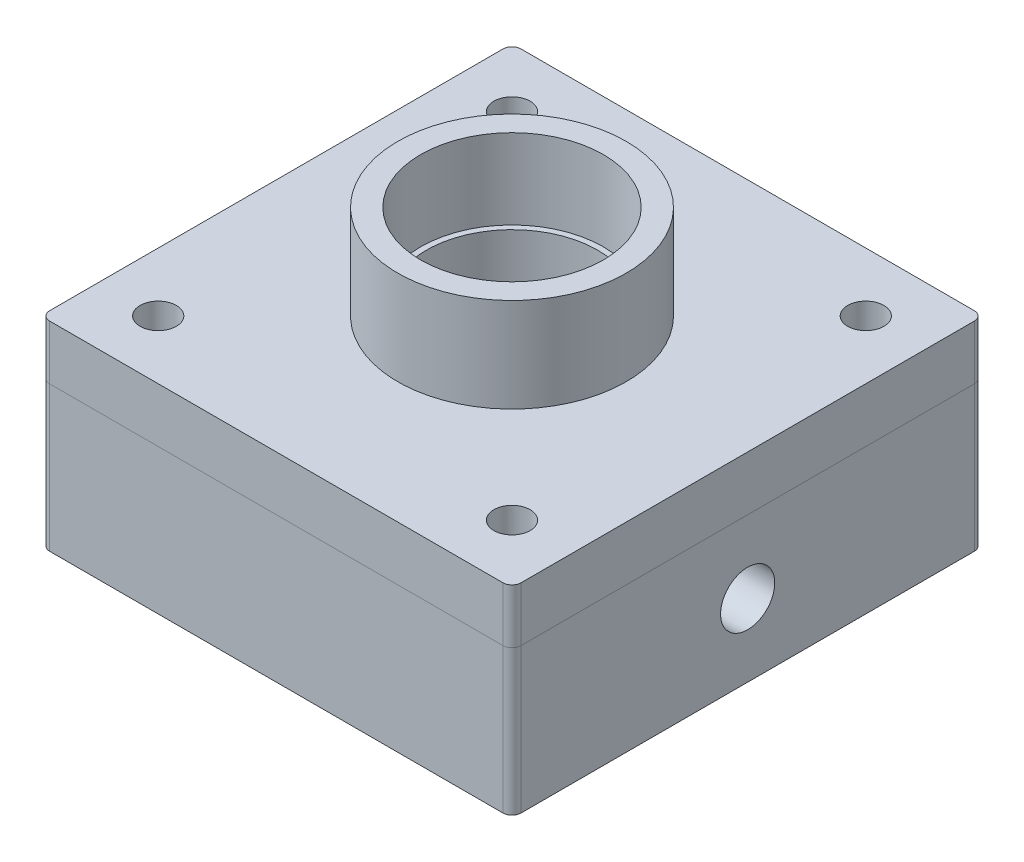
from build123d import *

# Parameters (mm, degrees)
SKETCH1_R                  = 40
SKETCH1_R_2                = 32
BOSS_EXTRUDE1_DEPTH        = 102.8
SKETCH1_3_R                = 32
SKETCH1_3_R_2              = 30
BOSS_EXTRUDE2_DEPTH        = 74.8
SKETCH1_4_R                = 30
SKETCH1_4_R_2              = 20
BOSS_EXTRUDE3_DEPTH        = 52.8
SKETCH1_5_W                = 165.1
SKETCH1_5_H                = 165.1
SKETCH1_5_R                = 6.35
SKETCH1_5_R_2              = 40
BOSS_EXTRUDE4_DEPTH        = 50.8
SKETCH2_R                  = 76.2
SKETCH2_R_2                = 69.85
CUT_EXTRUDE1_DEPTH         = 8
F_1_0MM_DOWEL_HOLE1_D      = 18.97
F_1_0MM_DOWEL_HOLE1_DEPTH  = 47.24
F_1_0MM_DOWEL_HOLE1_TIP    = 5.476167303
F_1_0MM_DOWEL_HOLE3_REACH  = 157.553
F_1_0MM_DOWEL_HOLE3_BORE_R = 6.35
SKETCH12_W                 = 165.1
SKETCH12_H                 = 165.1
SKETCH12_R                 = 40
SKETCH12_R_2               = 6.35
BOSS_EXTRUDE5_DEPTH        = 19.05
FILLET3_R                  = 3.175
FILLET4_R                  = 3.175


with BuildPart() as part:
    # Sketch1 → Boss-Extrude1 (new body)
    with BuildSketch(Plane(origin=(0, 0, 0), x_dir=(1, 0, 0), z_dir=(0, 1, 0))):
        with Locations(Location((0, 0, 0), (0, 0, 90))):
            Circle(SKETCH1_R)
        with Locations(Location((0, 0, 0), (0, 0, 90))):
            Circle(SKETCH1_R_2, mode=Mode.SUBTRACT)
    extrude(amount=BOSS_EXTRUDE1_DEPTH)

    # Sketch1<3> → Boss-Extrude2 (add)
    with BuildSketch(Plane(origin=(0, 0, 0), x_dir=(1, 0, 0), z_dir=(0, 1, 0))):
        with Locations(Location((0, 0, 0), (0, 0, 90))):
            Circle(SKETCH1_3_R)
        with Locations(Location((0, 0, 0), (0, 0, 270))):
            Circle(SKETCH1_3_R_2, mode=Mode.SUBTRACT)
    extrude(amount=BOSS_EXTRUDE2_DEPTH)

    # Sketch1<4> → Boss-Extrude3 (add)
    with BuildSketch(Plane(origin=(0, 0, 0), x_dir=(1, 0, 0), z_dir=(0, 1, 0))):
        with Locations(Location((0, 0, 0), (0, 0, 270))):
            Circle(SKETCH1_4_R)
        with Locations(Location((0, 0, 0), (0, 0, 270))):
            Circle(SKETCH1_4_R_2, mode=Mode.SUBTRACT)
    extrude(amount=BOSS_EXTRUDE3_DEPTH)

    # Sketch1<5> → Boss-Extrude4 (add)
    with BuildSketch(Plane(origin=(0, 0, 0), x_dir=(1, 0, 0), z_dir=(0, 1, 0))):
        Rectangle(SKETCH1_5_W, SKETCH1_5_H)
        with Locations(Location((-61.963767235, -61.963767235, 0), (0, 0, 270))):
            Circle(SKETCH1_5_R, mode=Mode.SUBTRACT)
        with Locations(Location((61.963767235, -61.963767235, 0), (0, 0, 270))):
            Circle(SKETCH1_5_R, mode=Mode.SUBTRACT)
        with Locations(Location((61.963767235, 61.963767235, 0), (0, 0, 270))):
            Circle(SKETCH1_5_R, mode=Mode.SUBTRACT)
        with Locations(Location((-61.963767235, 61.963767235, 0), (0, 0, 270))):
            Circle(SKETCH1_5_R, mode=Mode.SUBTRACT)
        with Locations(Location((0, 0, 0), (0, 0, 90))):
            Circle(SKETCH1_5_R_2, mode=Mode.SUBTRACT)
    extrude(amount=BOSS_EXTRUDE4_DEPTH)

    # Sketch2 → Cut-Extrude1 (cut)
    with BuildSketch(Plane.XZ):
        with Locations(Location((0, 0, 0), (0, 0, 270))):
            Circle(SKETCH2_R)
        with Locations(Location((0, 0, 0), (0, 0, 270))):
            Circle(SKETCH2_R_2, mode=Mode.SUBTRACT)
    extrude(amount=-CUT_EXTRUDE1_DEPTH, mode=Mode.SUBTRACT)

    # Ø1.0mm Dowel Hole1
    with Locations(Plane(origin=(82.55, 0, 0), x_dir=(0, 0, -1), z_dir=(1, 0, 0))):
        with Locations((0, 25.4)):
            Hole(F_1_0MM_DOWEL_HOLE1_D / 2, depth=F_1_0MM_DOWEL_HOLE1_DEPTH)
            with Locations((0, 0, -(F_1_0MM_DOWEL_HOLE1_DEPTH + F_1_0MM_DOWEL_HOLE1_TIP / 2))):  # 120° drill point
                Cone(0, F_1_0MM_DOWEL_HOLE1_D / 2, F_1_0MM_DOWEL_HOLE1_TIP, mode=Mode.SUBTRACT)

    # Ø1.0mm Dowel Hole3 bore → Ø1.0mm Dowel Hole3 (cut, up to next)
    with BuildSketch(Plane(origin=(0, 0, 0), x_dir=(-1, 0, 0), z_dir=(0, -1, 0)), mode=Mode.PRIVATE) as f_1_0mm_dowel_hole3_sk1:
        with Locations((-50.55, 0)):
            Circle(F_1_0MM_DOWEL_HOLE3_BORE_R)
    f_1_0mm_dowel_hole3_tool1 = extrude(f_1_0mm_dowel_hole3_sk1.sketch, amount=-F_1_0MM_DOWEL_HOLE3_REACH, mode=Mode.PRIVATE) & part.part
    add(f_1_0mm_dowel_hole3_tool1.solids().sort_by_distance((50.55, 0, 0))[0], mode=Mode.SUBTRACT)

    # Fillet3
    fillet3_edges = [part.edges().sort_by_distance(p)[0] for p in [
        (82.55, 25.4, 82.55),
        (82.55, 25.4, -82.55),
        (-82.55, 25.4, -82.55),
        (-82.55, 25.4, 82.55),
    ]]
    fillet(fillet3_edges, radius=FILLET3_R)


with BuildPart() as body_2:
    # Sketch12 → Boss-Extrude5 (new body)
    with BuildSketch(Plane(origin=(0, 50.8, 0), x_dir=(1, 0, 0), z_dir=(0, 1, 0))):
        Rectangle(SKETCH12_W, SKETCH12_H)
        with Locations(Location((0, 0, 0), (0, 0, 90))):
            Circle(SKETCH12_R, mode=Mode.SUBTRACT)
        with Locations(Location((-61.963767235, -61.963767235, 0), (0, 0, 90))):
            Circle(SKETCH12_R_2, mode=Mode.SUBTRACT)
        with Locations(Location((-61.963767235, 61.963767235, 0), (0, 0, 90))):
            Circle(SKETCH12_R_2, mode=Mode.SUBTRACT)
        with Locations(Location((61.963767235, 61.963767235, 0), (0, 0, 90))):
            Circle(SKETCH12_R_2, mode=Mode.SUBTRACT)
        with Locations(Location((61.963767235, -61.963767235, 0), (0, 0, 90))):
            Circle(SKETCH12_R_2, mode=Mode.SUBTRACT)
    extrude(amount=BOSS_EXTRUDE5_DEPTH)

    # Fillet4
    fillet4_edges = [body_2.edges().sort_by_distance(p)[0] for p in [
        (-82.55, 60.325, 82.55),
        (-82.55, 60.325, -82.55),
        (82.55, 60.325, -82.55),
        (82.55, 60.325, 82.55),
    ]]
    fillet(fillet4_edges, radius=FILLET4_R)


solid = Compound([part.part, body_2.part])
